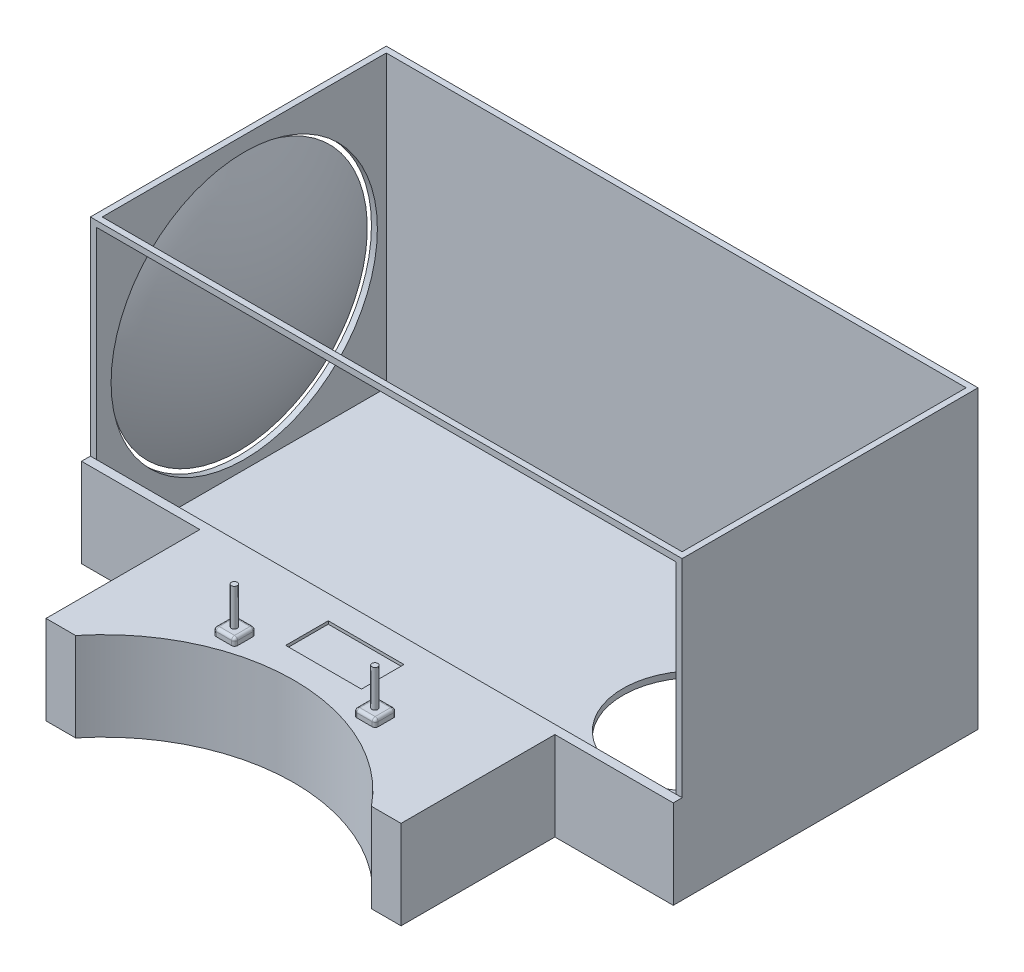
from build123d import *

# Parameters (mm, degrees)
EXTRUDE_1_DEPTH      = 500
EXTRUDE_1_DEPTH_BACK = 500
SKETCH_2_W           = 2000
SKETCH_2_H           = 1000
SKETCH_3_W           = 1960
SKETCH_3_H           = 960
CUT_EXTRUDE_1_DEPTH  = 980
SKETCH_4_W           = 1960
SKETCH_4_H           = 960
CUT_EXTRUDE_2_DEPTH  = 100
SKETCH_5_R           = 450
CUT_EXTRUDE_3_DEPTH  = 100
SKETCH_8_R           = 1000
CUT_EXTRUDE_4_DEPTH  = 1900
SKETCH_9_W           = 2000
SKETCH_9_H           = 300
EXTRUDE_2_DEPTH      = 300
EXTRUDE_3_DEPTH      = 300
CUT_EXTRUDE_5_DEPTH  = 10
SKETCH_14_W          = 72
SKETCH_14_H          = 72
EXTRUDE_4_DEPTH      = 25
FILLET_1_R           = 10
SKETCH_15_R          = 10
EXTRUDE_5_DEPTH      = 125
SKETCH_16_R          = 250
CUT_EXTRUDE_6_DEPTH  = 125
CUT_EXTRUDE_7_DEPTH  = 280
SKETCH_18_W          = 400
SKETCH_18_H          = 520
CUT_EXTRUDE_9_DEPTH  = 344
SKETCH_19_R          = 200
CUT_EXTRUDE_10_DEPTH = 50
SKETCH_20_R          = 100
CUT_EXTRUDE_11_DEPTH = 25


with BuildPart() as part:
    # 草图2 → 凸台-拉伸1 (new, two sides: drawn at the far end of the back side and taken through both)
    with BuildSketch(Plane(origin=(0, 0, 0), x_dir=(1, 0, 0), z_dir=(0, 1, 0)).offset(-EXTRUDE_1_DEPTH_BACK)):
        Rectangle(SKETCH_2_W, SKETCH_2_H)
    extrude(amount=EXTRUDE_1_DEPTH + EXTRUDE_1_DEPTH_BACK)

    # 草图3 → 切除-拉伸1 (cut)
    with BuildSketch(Plane(origin=(0, 500, 0), x_dir=(1, 0, 0), z_dir=(0, 1, 0))):
        Rectangle(SKETCH_3_W, SKETCH_3_H)
    extrude(amount=-CUT_EXTRUDE_1_DEPTH, mode=Mode.SUBTRACT)

    # 草图4 → 切除-拉伸2 (cut)
    with BuildSketch(Plane.XY.offset(500)):
        Rectangle(SKETCH_4_W, SKETCH_4_H)
    extrude(amount=-CUT_EXTRUDE_2_DEPTH, mode=Mode.SUBTRACT)

    # 草图5 → 切除-拉伸3 (cut)
    with BuildSketch(Plane.ZY.offset(1000)):
        Circle(SKETCH_5_R)
    extrude(amount=-CUT_EXTRUDE_3_DEPTH, mode=Mode.SUBTRACT)

    # 草图9 → 凸台-拉伸2 (add)
    with BuildSketch(Plane.XY.offset(500)):
        with Locations((0, -350)):
            Rectangle(SKETCH_9_W, SKETCH_9_H)
    extrude(amount=EXTRUDE_2_DEPTH)

    # 草图10 → 凸台-拉伸3 (add)
    with BuildSketch(Plane.XZ.offset(500)):
        with BuildLine():
            Line((-1000, 800), (-1000, 1050))
            Line((-1000, 1050), (-500, 1050))
            ThreePointArc((-500, 1050), (0, 811.84149191), (500, 1050))
            Line((500, 1050), (1000, 1050))
            Line((1000, 1050), (1000, 800))
            Line((1000, 800), (-1000, 800))
        make_face()
    extrude(amount=-EXTRUDE_3_DEPTH)

    # 草图12 → 切除-拉伸5 (cut)
    with BuildSketch(Plane(origin=(0, -200, 0), x_dir=(1, 0, 0), z_dir=(0, 1, 0))):
        Polygon((12.007636207, -580), (140.007636207, -580), (140.007636207, -724), (-115.992363793, -724), (-115.992363793, -580), align=None)
    extrude(amount=-CUT_EXTRUDE_5_DEPTH, mode=Mode.SUBTRACT)

    # 草图14 → 凸台-拉伸4 (add)
    with BuildSketch(Plane(origin=(0, -200, 0), x_dir=(1, 0, 0), z_dir=(0, 1, 0))):
        with Locations((-232.498542731, -780)):
            Rectangle(SKETCH_14_W, SKETCH_14_H)
        with Locations((242.531176757, -780)):
            Rectangle(SKETCH_14_W, SKETCH_14_H)
    extrude(amount=EXTRUDE_4_DEPTH)

    # 圆角1
    fillet_1_edges = [part.edges().sort_by_distance(p)[0] for p in [
        (278.531176757, -187.5, 744),
        (206.531176757, -187.5, 744),
        (278.531176757, -187.5, 816),
        (242.531176757, -175, 744),
        (206.531176757, -187.5, 816),
        (278.531176757, -175, 780),
        (242.531176757, -175, 816),
        (206.531176757, -175, 780),
        (-196.498542731, -187.5, 744),
        (-268.498542731, -187.5, 744),
        (-268.498542731, -187.5, 816),
        (-196.498542731, -187.5, 816),
        (-232.498542731, -175, 744),
        (-196.498542731, -175, 780),
        (-268.498542731, -175, 780),
        (-232.498542731, -175, 816),
    ]]
    fillet(fillet_1_edges, radius=FILLET_1_R)

    # 草图15 → 凸台-拉伸5 (add)
    with BuildSketch(Plane(origin=(0, -175, 0), x_dir=(1, 0, 0), z_dir=(0, 1, 0))):
        with Locations((242.501457269, -781)):
            Circle(SKETCH_15_R)
        with Locations((-232.498542731, -781)):
            Circle(SKETCH_15_R)
    extrude(amount=EXTRUDE_5_DEPTH)

    # 草图16 → 切除-拉伸6 (cut)
    with BuildSketch(Plane(origin=(0, -480, 0), x_dir=(1, 0, 0), z_dir=(0, 1, 0))):
        with Locations((550, 0)):
            Circle(SKETCH_16_R)
    extrude(amount=-CUT_EXTRUDE_6_DEPTH, mode=Mode.SUBTRACT)

    # 草图17 → 切除-拉伸7 (cut)
    with BuildSketch(Plane.XZ.offset(500)):
        Polygon((14.012635686, 790), (313.153045599, 790), (313.153045599, 550), (-286.846954401, 550), (-286.846954401, 790), align=None)
    extrude(amount=-CUT_EXTRUDE_7_DEPTH, mode=Mode.SUBTRACT)

    # 草图18 → 切除-拉伸9 (cut)
    with BuildSketch(Plane(origin=(0, -200, 0), x_dir=(1, 0, 0), z_dir=(0, 1, 0))):
        with Locations((-800, -790)):
            Rectangle(SKETCH_18_W, SKETCH_18_H)
        with Locations((800, -790)):
            Rectangle(SKETCH_18_W, SKETCH_18_H)
    extrude(amount=-CUT_EXTRUDE_9_DEPTH, mode=Mode.SUBTRACT)


with BuildPart() as body_2:
    # 草图6 → 旋转4 (revolve)
    with BuildSketch(Plane(origin=(0, 0, 0), x_dir=(1, 0, 0), z_dir=(0, 1, 0))):
        with BuildLine():
            Line((-900, 0), (-2900, 0))
            ThreePointArc((-2900, 0), (-1900, 1000), (-900, 0))
        make_face()
    revolve(axis=Axis((-896.177717, 0, 0), (1, 0, 0)))

    # 草图8 → 切除-拉伸4 (cut)
    with BuildSketch(Plane.ZY.offset(1000)):
        Circle(SKETCH_8_R)
    extrude(amount=CUT_EXTRUDE_4_DEPTH, mode=Mode.SUBTRACT)

    # 草图19 → 切除-拉伸10 (cut)
    with BuildSketch(Plane.ZY.offset(1000)):
        Circle(SKETCH_19_R)
    extrude(amount=-CUT_EXTRUDE_10_DEPTH, mode=Mode.SUBTRACT)

    # 草图20 → 切除-拉伸11 (cut)
    with BuildSketch(Plane.ZY.offset(950)):
        Circle(SKETCH_20_R)
    extrude(amount=-CUT_EXTRUDE_11_DEPTH, mode=Mode.SUBTRACT)


solid = Compound([part.part, body_2.part])
